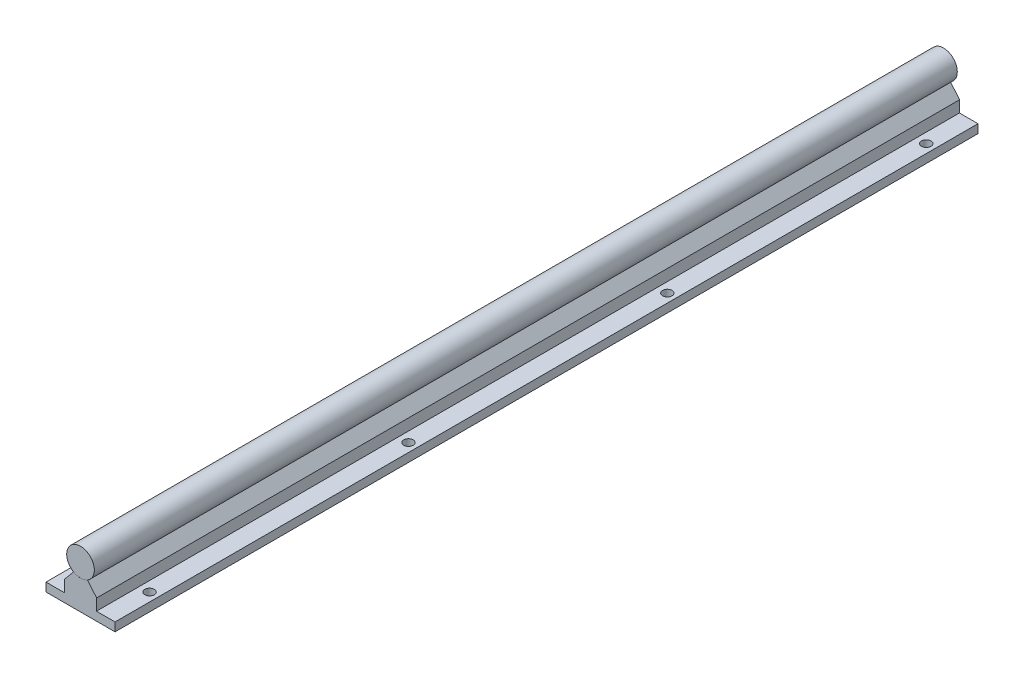
from build123d import *

# Parameters (mm, degrees)
SKETCH1_R          = 8
EXTRUDE1_DEPTH     = 500
EXTRUDE3_DEPTH     = 500
SKETCH8_R          = 2.75
CUT_EXTRUDE1_DEPTH = 5
LPATTERN1_COUNT    = 4
LPATTERN1_PITCH    = 150


with BuildPart() as part:
    # Sketch1 → Extrude1 (new body)
    with BuildSketch(Plane.XY):
        with Locations((0, -1.825456957)):
            Circle(SKETCH1_R)
    extrude(amount=EXTRUDE1_DEPTH)


with BuildPart() as body_2:
    # Sketch2 → Extrude3 (new body)
    with BuildSketch(Plane.XY):
        with BuildLine():
            Line((4, -8.753660187), (9.346572319, -15.125456957))
            Line((9.346572319, -15.125456957), (9.25, -15.125456957))
            Line((9.25, -15.125456957), (9.25, -21.825456957))
            Line((9.25, -21.825456957), (20, -21.825456957))
            Line((20, -21.825456957), (20, -26.825456957))
            Line((20, -26.825456957), (0, -26.825456957))
            Line((0, -26.825456957), (0, -9.825456957))
            ThreePointArc((0, -9.825456957), (2.070552361, -9.552863567), (4, -8.753660187))
        make_face()
    extrude(amount=EXTRUDE3_DEPTH)


with BuildPart() as body_3:
    # Mirror5: mirrored copy
    add(body_2.part.mirror(Plane(origin=(0, -26.825456957, 500), x_dir=(0, 0, 1), z_dir=(1, 0, 0))))

    # Combine1: union body 2
    add(body_2.part)

    # Sketch8 → Cut-Extrude1 (cut)
    with BuildSketch(Plane.XZ.offset(26.825456957)):
        with Locations((-15, 475)):
            Circle(SKETCH8_R)
        with Locations((15, 475)):
            Circle(SKETCH8_R)
    cut_extrude1 = extrude(amount=-CUT_EXTRUDE1_DEPTH, mode=Mode.SUBTRACT)

    # LPattern1: Cut-Extrude1 ×4
    with Locations(*[(0, 0, -i * LPATTERN1_PITCH) for i in range(1, LPATTERN1_COUNT)]):
        add(cut_extrude1, mode=Mode.SUBTRACT)


solid = Compound([part.part, body_3.part])
